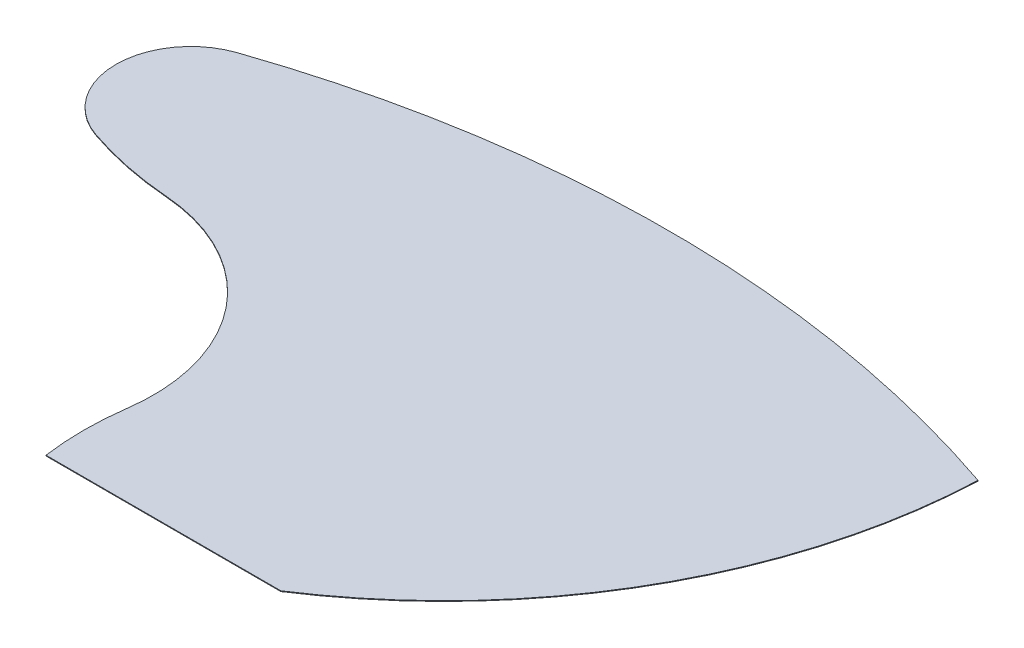
from build123d import *

# Parameters (mm, degrees)
BOSS_EXTRUDE1_DEPTH = 0.2


with BuildPart() as part:
    # Sketch1 → Boss-Extrude1 (new body)
    with BuildSketch(Plane(origin=(0, 0, 0), x_dir=(1, 0, 0), z_dir=(0, 1, 0))):
        with BuildLine():
            Line((77.011811156, 6.964256389), (142.011811156, 6.964256389))
            ThreePointArc((142.011811156, 6.964256389), (191.952101905, 59.934908511), (212.011811156, 129.917268368))
            ThreePointArc((212.011811156, 129.917268368), (109.511811156, 146.964256388), (7.011811156, 129.917268368))
            ThreePointArc((7.011811156, 129.917268368), (-6.988188844, 110.331559293), (7.011811156, 90.745850217))
            ThreePointArc((7.011811156, 90.745850217), (19.183532895, 87.425752447), (31.677095604, 85.669406772))
            ThreePointArc((31.677095604, 85.669406772), (66.484712456, 67.363163439), (77.011811156, 29.470302254))
            ThreePointArc((77.011811156, 29.470302254), (76.24065583, 18.217279321), (77.011811156, 6.964256389))
        make_face()
    extrude(amount=BOSS_EXTRUDE1_DEPTH)


solid = part.part
